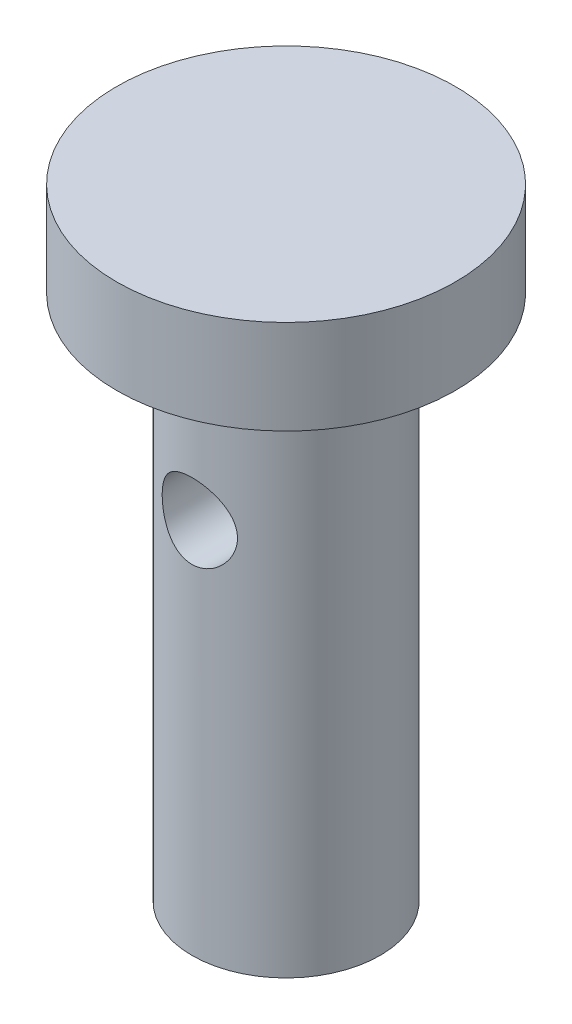
from build123d import *

# Parameters (mm, degrees)
CROQUIS1_R              = 2.5
SALIENTE_EXTRUIR1_DEPTH = 14
CROQUIS2_R              = 4.5
SALIENTE_EXTRUIR2_DEPTH = 2.5
CROQUIS3_R              = 1
CORTAR_EXTRUIR1_DEPTH   = 3


with BuildPart() as part:
    # Croquis1 → Saliente-Extruir1 (new body)
    with BuildSketch(Plane(origin=(0, 0, 0), x_dir=(1, 0, 0), z_dir=(0, 1, 0))):
        with Locations(Location((0, 0, 0), (0, 0, 270))):
            Circle(CROQUIS1_R)
    extrude(amount=SALIENTE_EXTRUIR1_DEPTH)

    # Croquis2 → Saliente-Extruir2 (add)
    with BuildSketch(Plane(origin=(0, 14, 0), x_dir=(1, 0, 0), z_dir=(0, 1, 0))):
        with Locations(Location((0, 0, 0), (0, 0, 270))):
            Circle(CROQUIS2_R)
    extrude(amount=SALIENTE_EXTRUIR2_DEPTH)

    # Croquis3 → Cortar-Extruir1 (cut, symmetric)
    with BuildSketch(Plane.XY):
        with Locations(Location((0, 10, 0), (0, 0, 89.999999999))):
            Circle(CROQUIS3_R)
    extrude(amount=CORTAR_EXTRUIR1_DEPTH, both=True, mode=Mode.SUBTRACT)


solid = part.part
